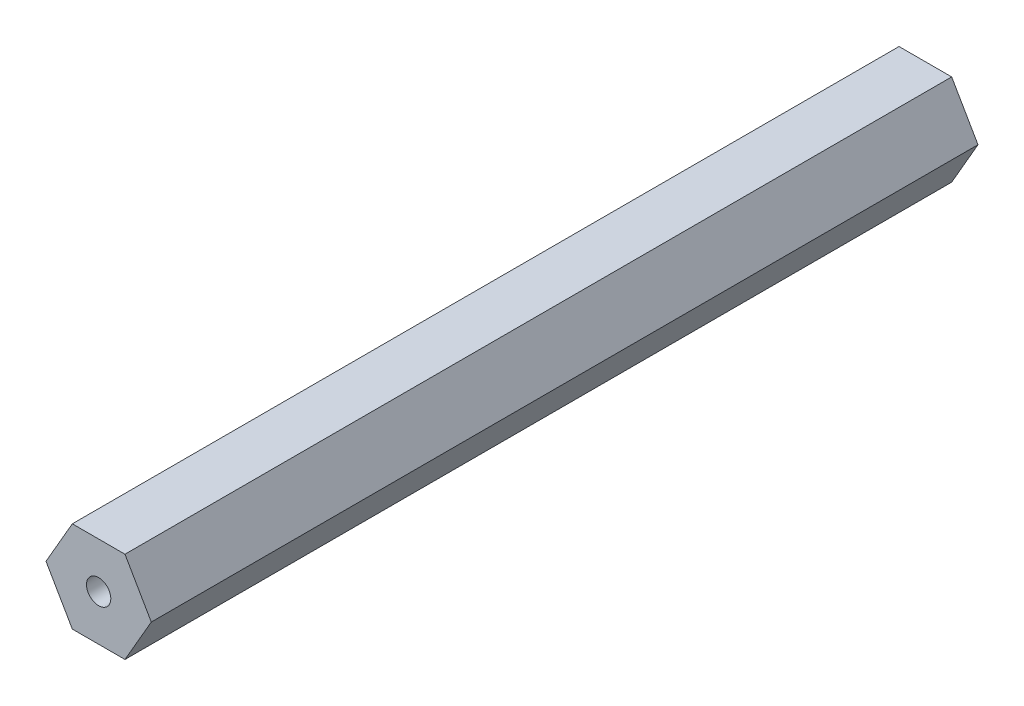
from build123d import *

# Parameters (mm, degrees)
SKETCH1_R           = 1.27
BOSS_EXTRUDE1_DEPTH = 86.36


with BuildPart() as part:
    # Sketch1 → Boss-Extrude1 (new body)
    with BuildSketch(Plane.XY):
        Polygon((16.408039326, -2.667590064), (13.658408669, 2.094909936), (8.159147355, 2.094909936), (5.409516698, -2.667590064), (8.159147355, -7.430090064), (13.658408669, -7.430090064), align=None)
        with Locations((10.908778012, -2.667590064)):
            Circle(SKETCH1_R, mode=Mode.SUBTRACT)
    extrude(amount=BOSS_EXTRUDE1_DEPTH)


solid = part.part
